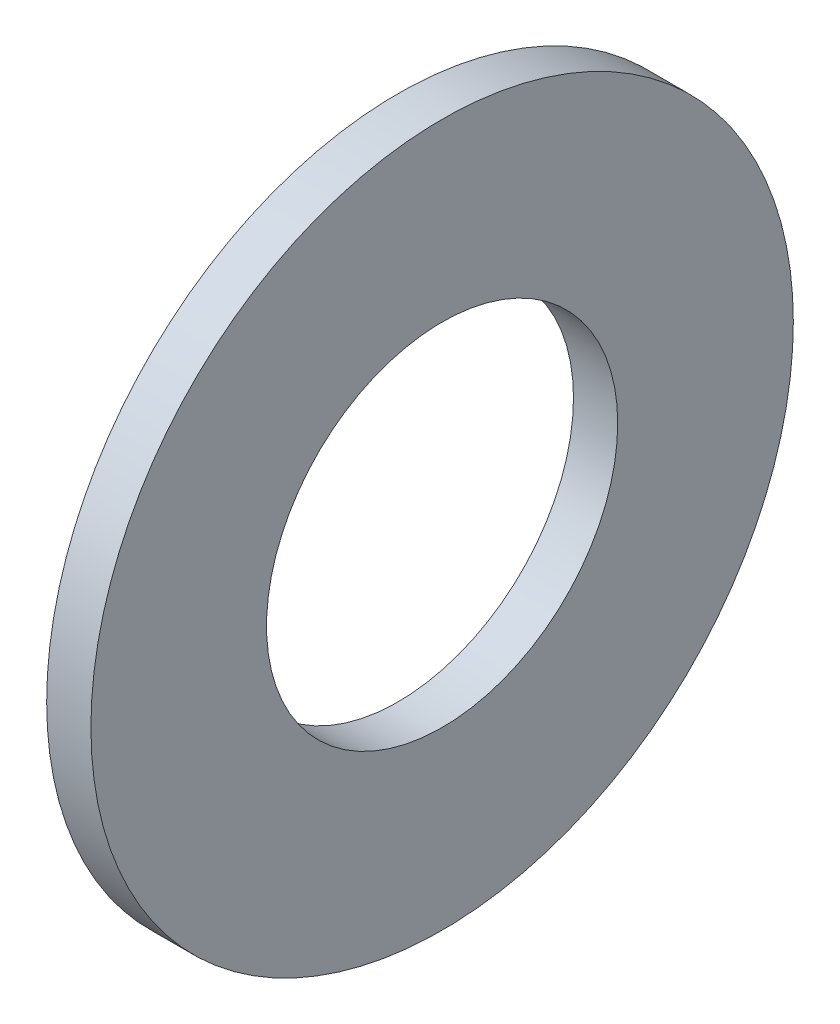
from build123d import *

# Parameters (mm, degrees)
SKETCH1_R           = 6.35
SKETCH1_R_2         = 3.175
BOSS_EXTRUDE1_DEPTH = 0.8


with BuildPart() as part:
    # Sketch1 → Boss-Extrude1 (new body)
    with BuildSketch(Plane(origin=(0, 0, 0), x_dir=(0, 0, -1), z_dir=(1, 0, 0))):
        Circle(SKETCH1_R)
        Circle(SKETCH1_R_2, mode=Mode.SUBTRACT)
    extrude(amount=BOSS_EXTRUDE1_DEPTH)


solid = part.part
